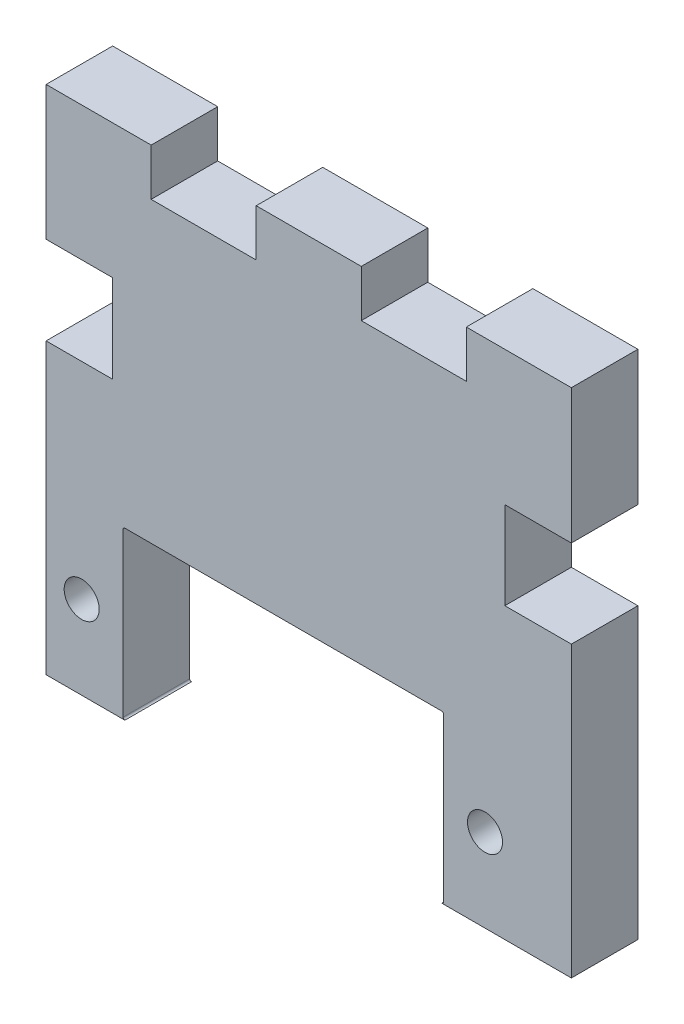
from build123d import *

# Parameters (mm, degrees)
SKETCH1_W           = 38.1
SKETCH1_H           = 37.084
BOSS_EXTRUDE1_DEPTH = 4.826
SKETCH3_R           = 1.27
CUT_EXTRUDE2_DEPTH  = 54.386546358
CUT_EXTRUDE3_DEPTH  = 54.386546358
SKETCH5_W           = 7.62
SKETCH5_H           = 3.409901171
CUT_EXTRUDE4_DEPTH  = 54.386546358
SKETCH7_W           = 4.826
SKETCH7_H           = 6.380433542
SKETCH7_H_2         = 6.35
CUT_EXTRUDE5_DEPTH  = 54.386546358


with BuildPart() as part:
    # Sketch1 → Boss-Extrude1 (new body)
    with BuildSketch(Plane.XY):
        with Locations((19.05, 18.542)):
            Rectangle(SKETCH1_W, SKETCH1_H)
    extrude(amount=BOSS_EXTRUDE1_DEPTH)

    # Sketch3 → Cut-Extrude2 (cut, through all)
    with BuildSketch(Plane.XY.offset(4.826)):
        with Locations((2.580480538, 6.0325)):
            Circle(SKETCH3_R)
        with Locations((31.836519462, 6.0325)):
            Circle(SKETCH3_R)
    extrude(amount=-CUT_EXTRUDE2_DEPTH, mode=Mode.SUBTRACT)

    # Sketch4 → Cut-Extrude3 (cut, through all)
    with BuildSketch(Plane(origin=(0, 0, 0), x_dir=(-1, 0, 0), z_dir=(0, 0, -1))):
        with BuildLine():
            Line((-28.702, 12.065), (-5.715, 12.065))
            ThreePointArc((-5.715, 12.065), (-5.625197439, 12.027802561), (-5.588, 11.938))
            Line((-5.588, 11.938), (-5.588, 0.127))
            ThreePointArc((-5.588, 0.127), (-5.625197439, 0.037197439), (-5.715, 0))
            Line((-5.715, 0), (-28.702, 0))
            ThreePointArc((-28.702, 0), (-28.791802561, 0.037197439), (-28.829, 0.127))
            Line((-28.829, 0.127), (-28.829, 11.938))
            ThreePointArc((-28.829, 11.938), (-28.791802561, 12.027802561), (-28.702, 12.065))
        make_face()
    extrude(amount=-CUT_EXTRUDE3_DEPTH, mode=Mode.SUBTRACT)

    # Sketch5 → Cut-Extrude4 (cut, through all)
    with BuildSketch(Plane.XY.offset(4.826)):
        with Locations((11.43, 35.379049415)):
            Rectangle(SKETCH5_W, SKETCH5_H)
        with Locations((26.67, 35.379049415)):
            Rectangle(SKETCH5_W, SKETCH5_H)
    extrude(amount=-CUT_EXTRUDE4_DEPTH, mode=Mode.SUBTRACT)

    # Sketch7 → Cut-Extrude5 (cut, through all)
    with BuildSketch(Plane.XY.offset(4.826)):
        with Locations((2.413, 24.1643156)):
            Rectangle(SKETCH7_W, SKETCH7_H)
        with Locations((35.687, 24.149098829)):
            Rectangle(SKETCH7_W, SKETCH7_H_2)
    extrude(amount=-CUT_EXTRUDE5_DEPTH, mode=Mode.SUBTRACT)


solid = part.part
